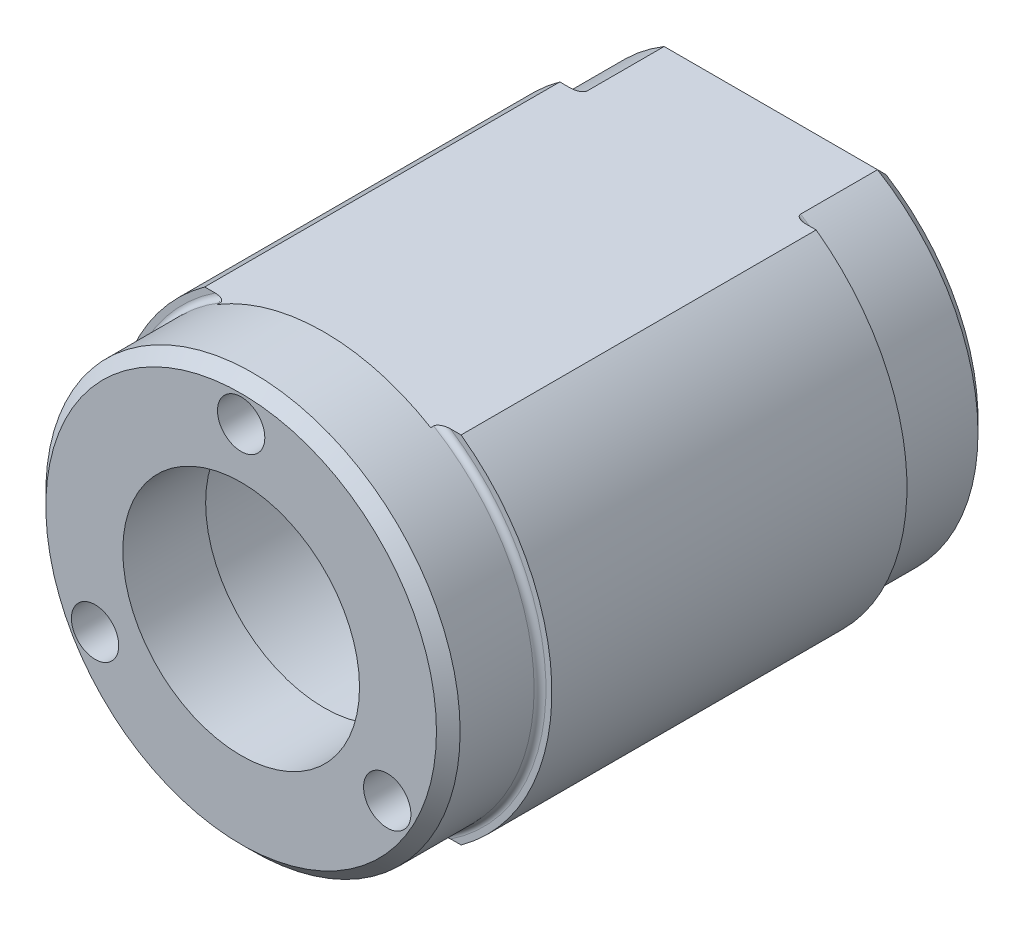
from build123d import *

# Parameters (mm, degrees)
BOSS_EXTRUDE1_DEPTH         = 22.75
BOSS_EXTRUDE1_DEPTH_BACK    = 23
SKETCH1_R                   = 11.5
BOSS_EXTRUDE2_DEPTH         = 15
BOSS_EXTRUDE2_DEPTH_BACK    = 15
BOSS_EXTRUDE3_START         = -7
SKETCH5_R                   = 17.5
SKETCH5_R_2                 = 10
BOSS_EXTRUDE3_DEPTH         = 7
SKETCH6_R                   = 2
CUT_EXTRUDE1_DEPTH          = 5
M3_TAPPED_HOLE1_D           = 2.5
M3_TAPPED_HOLE1_DEPTH       = 7.5
M3_TAPPED_HOLE1_CSINK_D     = 3.05
M3_TAPPED_HOLE1_CSINK_ANGLE = 90
M3_TAPPED_HOLE1_TIP         = 0.751075774
FILLET2_R                   = 0.5
CHAMFER1_SIZE               = 1
CHAMFER2_SIZE               = 1


with BuildPart() as part:
    # Sketch1 → Boss-Extrude1 (new, two sides: drawn at the far end of the back side and taken through both)
    with BuildSketch(Plane.XY.offset(-BOSS_EXTRUDE1_DEPTH_BACK)):
        with BuildLine():
            Line((9.013878189, 15), (-9.013878189, 15))
            ThreePointArc((-9.013878189, 15), (-17.5, 0), (-9.013878189, -15))
            Line((-9.013878189, -15), (9.013878189, -15))
            ThreePointArc((9.013878189, -15), (17.5, 0), (9.013878189, 15))
        make_face()
        Circle(SKETCH1_R, mode=Mode.SUBTRACT)
    extrude(amount=BOSS_EXTRUDE1_DEPTH + BOSS_EXTRUDE1_DEPTH_BACK)

    # Sketch1<23> → Boss-Extrude2 (add, two sides: drawn at the far end of the back side and taken through both)
    with BuildSketch(Plane.XY.offset(-BOSS_EXTRUDE2_DEPTH_BACK)):
        with BuildLine():
            Line((-9.013878189, 15), (-10.828203914, 15))
            ThreePointArc((-10.828203914, 15), (-18.5, 0), (-10.828203914, -15))
            Line((-10.828203914, -15), (-9.013878189, -15))
            ThreePointArc((-9.013878189, -15), (-17.5, 0), (-9.013878189, 15))
        make_face()
        with BuildLine():
            ThreePointArc((10.828203914, -15), (18.5, 0), (10.828203914, 15))
            Line((10.828203914, 15), (9.013878189, 15))
            ThreePointArc((9.013878189, 15), (17.5, 0), (9.013878189, -15))
            Line((9.013878189, -15), (10.828203914, -15))
        make_face()
    extrude(amount=BOSS_EXTRUDE2_DEPTH + BOSS_EXTRUDE2_DEPTH_BACK)

    # Sketch5 → Boss-Extrude3 (add)
    with BuildSketch(Plane.XY.offset(22.75).offset(BOSS_EXTRUDE3_START)):
        Circle(SKETCH5_R)
        Circle(SKETCH5_R_2, mode=Mode.SUBTRACT)
    extrude(amount=BOSS_EXTRUDE3_DEPTH)

    # Sketch6 → Cut-Extrude1 (cut)
    with BuildSketch(Plane.XY.offset(22.75)):
        with Locations((0, 14.25)):
            Circle(SKETCH6_R)
        with Locations((12.340862004, -7.125)):
            Circle(SKETCH6_R)
        with Locations((-12.340862004, -7.125)):
            Circle(SKETCH6_R)
    extrude(amount=-CUT_EXTRUDE1_DEPTH, mode=Mode.SUBTRACT)

    # M3 Tapped Hole1
    with Locations(Plane(origin=(0, -15, 0), x_dir=(-1, 0, 0), z_dir=(0, -1, 0))):
        with Locations((0, 0)):
            CounterSinkHole(M3_TAPPED_HOLE1_D / 2, M3_TAPPED_HOLE1_CSINK_D / 2, depth=M3_TAPPED_HOLE1_DEPTH, counter_sink_angle=M3_TAPPED_HOLE1_CSINK_ANGLE)
            with Locations((0, 0, -(M3_TAPPED_HOLE1_DEPTH + M3_TAPPED_HOLE1_TIP / 2))):  # 118° drill point
                Cone(0, M3_TAPPED_HOLE1_D / 2, M3_TAPPED_HOLE1_TIP, mode=Mode.SUBTRACT)

    # Fillet2
    fillet2_edges = [part.edges().sort_by_distance(p)[0] for p in [
        (-17.5, 0, -15),
        (17.5, 0, -15),
        (17.5, 0, 15),
        (-17.5, 0, 15),
    ]]
    fillet(fillet2_edges, radius=FILLET2_R)

    # Chamfer1
    chamfer1_edges = [part.edges().sort_by_distance(p)[0] for p in [
        (-9.013878189, 15, 22.75),
        (17.5, 0, -23),
        (-17.5, 0, -23),
    ]]
    chamfer(chamfer1_edges, length=CHAMFER1_SIZE)

    # Chamfer2
    chamfer2_edges = [part.edges().sort_by_distance(p)[0] for p in [
        (0, -15, -23),
        (0, 15, -23),
    ]]
    chamfer(chamfer2_edges, length=CHAMFER2_SIZE)


solid = part.part
